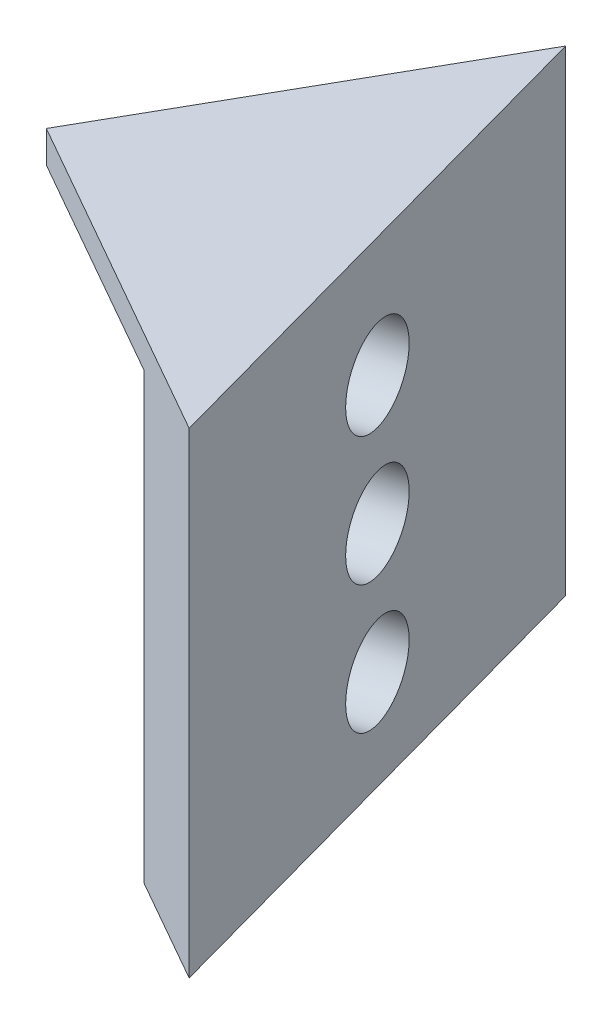
from build123d import *

# Parameters (mm, degrees)
BOSS_EXTRUDE1_DEPTH = 25.4
BOSS_EXTRUDE2_DEPTH = 381
SKETCH3_R           = 36.353481393
CUT_EXTRUDE1_DEPTH  = 381


with BuildPart() as part:
    # Sketch1 → Boss-Extrude1 (new body)
    with BuildSketch(Plane(origin=(0, 0, 0), x_dir=(1, 0, 0), z_dir=(0, 1, 0))):
        Polygon((0, 0), (264.960965784, -150.660965784), (150.660965784, 264.960965784), align=None)
    extrude(amount=BOSS_EXTRUDE1_DEPTH)

    # Sketch2 → Boss-Extrude2 (add)
    with BuildSketch(Plane(origin=(0, 25.4, 0), x_dir=(1, 0, 0), z_dir=(0, 1, 0))):
        Polygon((150.660965784, 264.960965784), (102.937728624, 181.032159524), (181.032159524, -102.937728624), (264.960965784, -150.660965784), align=None)
    extrude(amount=-BOSS_EXTRUDE2_DEPTH)

    # Sketch3 → Cut-Extrude1 (cut)
    with BuildSketch(Plane(origin=(141.984944074, 0, -39.04721545), x_dir=(0.26516504294494564, 0, 0.9642030387838472), z_dir=(-0.9642030387838472, 0, 0.26516504294494564))):
        with Locations((0, -70.290841781)):
            Circle(SKETCH3_R)
        with Locations((0, -173.124599598)):
            Circle(SKETCH3_R)
        with Locations((0, -275.958357416)):
            Circle(SKETCH3_R)
    extrude(amount=-CUT_EXTRUDE1_DEPTH, mode=Mode.SUBTRACT)


solid = part.part
